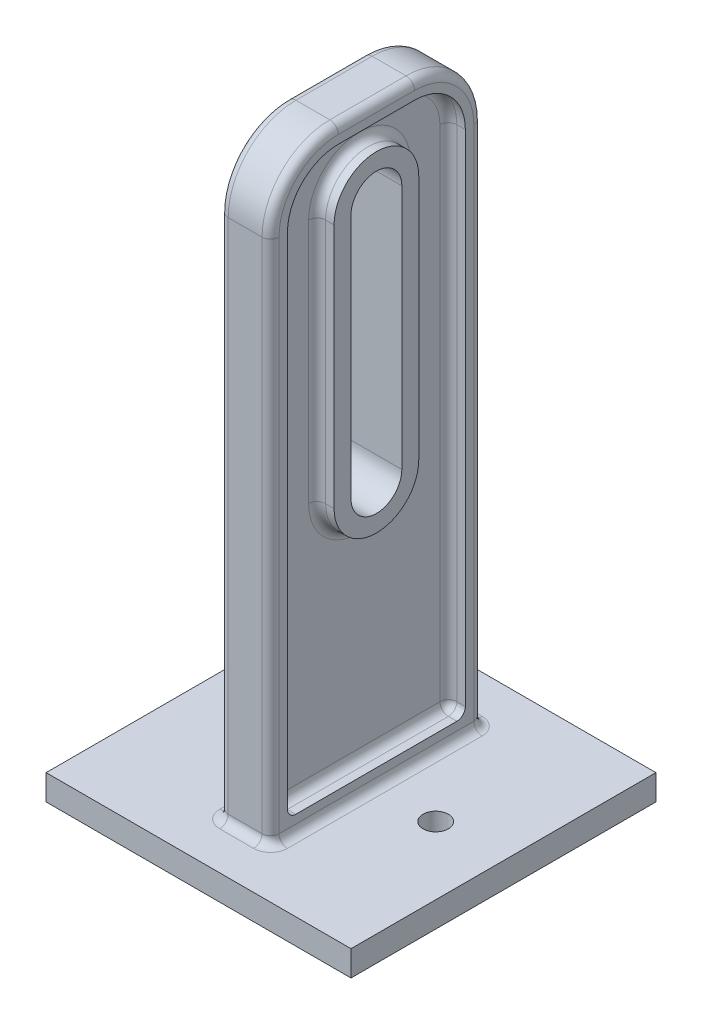
from build123d import *

# Parameters (mm, degrees)
SKETCH1_W           = 36
SKETCH1_H           = 36
BOSS_EXTRUDE1_DEPTH = 3
SKETCH2_R           = 1.5
CUT_EXTRUDE1_DEPTH  = 26.632011236
SKETCH3_W           = 6
SKETCH3_H           = 25
BOSS_EXTRUDE2_DEPTH = 70
CUT_EXTRUDE2_DEPTH  = 79.064076245
FILLET1_R           = 8
CUT_EXTRUDE3_DEPTH  = 2
FILLET2_R           = 1
FILLET3_R           = 1
FILLET6_R           = 1
FILLET7_R           = 1
FILLET8_R           = 1


with BuildPart() as part:
    # Sketch1 → Boss-Extrude1 (new body)
    with BuildSketch(Plane(origin=(0, 0, 0), x_dir=(1, 0, 0), z_dir=(0, 1, 0))):
        Rectangle(SKETCH1_W, SKETCH1_H)
    extrude(amount=BOSS_EXTRUDE1_DEPTH)

    # Sketch2 → Cut-Extrude1 (cut, through all)
    with BuildSketch(Plane(origin=(0, 3, 0), x_dir=(1, 0, 0), z_dir=(0, 1, 0))):
        with Locations(Location((-10, 0, 0), (0, 0, 270))):
            Circle(SKETCH2_R)
        with Locations(Location((10, 0, 0), (0, 0, 270))):
            Circle(SKETCH2_R)
    extrude(amount=-CUT_EXTRUDE1_DEPTH, mode=Mode.SUBTRACT)

    # Sketch3 → Boss-Extrude2 (add)
    with BuildSketch(Plane(origin=(0, 3, 0), x_dir=(1, 0, 0), z_dir=(0, 1, 0))):
        Rectangle(SKETCH3_W, SKETCH3_H)
    extrude(amount=BOSS_EXTRUDE2_DEPTH)

    # Sketch4 → Cut-Extrude2 (cut, through all)
    with BuildSketch(Plane.ZY.offset(3)):
        with BuildLine():
            Line((-3, 34), (-3, 63))
            ThreePointArc((-3, 63), (0, 66), (3, 63))
            Line((3, 63), (3, 34))
            ThreePointArc((3, 34), (0, 31), (-3, 34))
        make_face()
    extrude(amount=-CUT_EXTRUDE2_DEPTH, mode=Mode.SUBTRACT)

    # Fillet1
    fillet1_edges = [part.edges().sort_by_distance(p)[0] for p in [
        (0, 73, -12.5),
        (0, 73, 12.5),
    ]]
    fillet(fillet1_edges, radius=FILLET1_R)

    # Sketch5 → Cut-Extrude3 (cut)
    with BuildSketch(Plane.ZY.offset(3)):
        with BuildLine():
            Line((4.5, 71), (-4.5, 71))
            ThreePointArc((-4.5, 71), (-8.742640687, 69.242640687), (-10.5, 65))
            Line((-10.5, 65), (-10.5, 5))
            Line((-10.5, 5), (10.5, 5))
            Line((10.5, 5), (10.5, 65))
            ThreePointArc((10.5, 65), (8.742640687, 69.242640687), (4.5, 71))
        make_face()
        with BuildLine():
            Line((5, 34), (5, 63))
            ThreePointArc((5, 63), (0, 68), (-5, 63))
            Line((-5, 63), (-5, 34))
            ThreePointArc((-5, 34), (0, 29), (5, 34))
        make_face(mode=Mode.SUBTRACT)
    cut_extrude3 = extrude(amount=-CUT_EXTRUDE3_DEPTH, mode=Mode.SUBTRACT)

    # Mirror1: Cut-Extrude3 across plane
    add(cut_extrude3.mirror(Plane(origin=(0, 0, 0), x_dir=(0, 0, 1), z_dir=(1, 0, 0))), mode=Mode.SUBTRACT)

    # Fillet2
    fillet2_edges = [part.edges().sort_by_distance(p)[0] for p in [
        (-3, 73, 0),
        (-3, 34, 12.5),
        (-3, 34, -12.5),
        (-3, 70.656854249, 10.156854249),
        (-3, 70.656854249, -10.156854249),
        (-1, 69.242640687, 8.742640687),
        (-1, 35, 10.5),
        (-1, 35, -10.5),
        (-1, 69.242640687, -8.742640687),
        (-1, 71, 0),
        (-1, 48.5, -5),
        (-1, 29, 0),
        (-1, 48.5, 5),
        (-1, 68, 0),
    ]]
    fillet(fillet2_edges, radius=FILLET2_R)

    # Fillet3
    fillet3_edges = [part.edges().sort_by_distance(p)[0] for p in [
        (-1, 5, 0),
        (-2.5, 5, 10.5),
        (-2.5, 5, -10.5),
        (-1.292893219, 5, 10.207106781),
        (-1.292893219, 5, -10.207106781),
    ]]
    fillet(fillet3_edges, radius=FILLET3_R)

    # Fillet6
    fillet6_edges = [part.edges().sort_by_distance(p)[0] for p in [
        (1, 69.242640687, 8.742640687),
        (1, 71, 0),
        (1, 69.242640687, -8.742640687),
        (1, 35, -10.5),
        (1, 35, 10.5),
        (1, 29, 0),
        (1, 48.5, 5),
        (1, 68, 0),
        (1, 48.5, -5),
        (3, 73, 0),
        (3, 34, -12.5),
        (3, 34, 12.5),
        (3, 70.656854249, 10.156854249),
        (3, 70.656854249, -10.156854249),
    ]]
    fillet(fillet6_edges, radius=FILLET6_R)

    # Fillet7
    fillet7_edges = [part.edges().sort_by_distance(p)[0] for p in [
        (1, 5, 0),
        (2.5, 5, 10.5),
        (2.5, 5, -10.5),
        (1.292893219, 5, -10.207106781),
        (1.292893219, 5, 10.207106781),
    ]]
    fillet(fillet7_edges, radius=FILLET7_R)

    # Fillet8
    fillet8_edges = [part.edges().sort_by_distance(p)[0] for p in [
        (-3, 3, 0),
        (0, 3, 12.5),
        (-2.707106781, 3, -12.207106781),
        (-2.707106781, 3, 12.207106781),
        (0, 3, -12.5),
        (3, 3, 0),
        (2.707106781, 3, -12.207106781),
        (2.707106781, 3, 12.207106781),
    ]]
    fillet(fillet8_edges, radius=FILLET8_R)


solid = part.part
